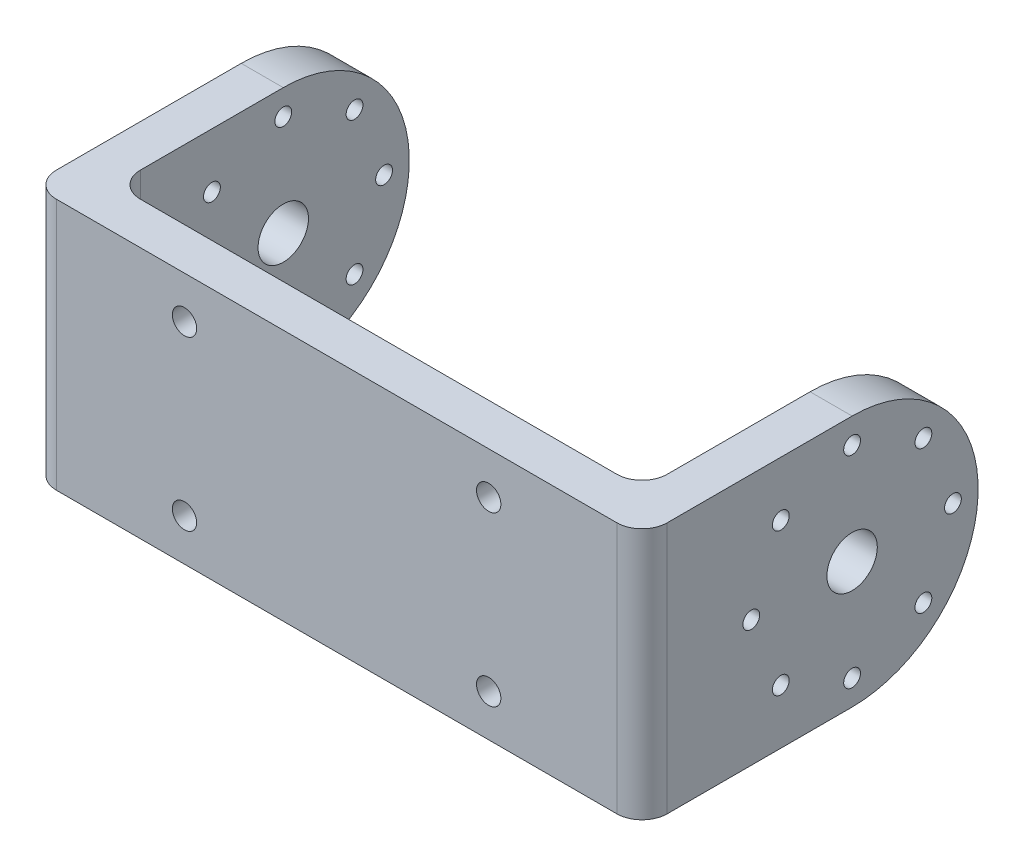
from build123d import *

# Parameters (mm, degrees)
BOSS_EXTRUDE1_DEPTH = 5
SKETCH4_W           = 5
SKETCH4_H           = 30
BOSS_EXTRUDE4_DEPTH = 35
SKETCH5_R           = 3
CUT_EXTRUDE2_DEPTH  = 40
CUT_EXTRUDE3_DEPTH  = 10
SKETCH7_R           = 1
SKETCH7_R_2         = 1.000000019
CUT_EXTRUDE4_DEPTH  = 10
FILLET2_R           = 3
FILLET3_R           = 3
FILLET5_R           = 3
FILLET6_R           = 3
SKETCH8_R           = 1.45
CUT_EXTRUDE6_DEPTH  = 4


with BuildPart() as part:
    # Sketch1 → Boss-Extrude1 (new body)
    with BuildSketch(Plane.XY):
        with BuildLine():
            Line((5, 0), (36.35, 0))
            Line((36.35, 0), (36.35, 15))
            Line((36.35, 15), (-36.35, 15))
            Line((-36.35, 15), (-36.35, 0))
            Line((-36.35, 0), (-5, 0))
            ThreePointArc((-5, 0), (0, 5), (5, 0))
        make_face()
        with BuildLine():
            ThreePointArc((-5, 0), (0, -5), (5, 0))
            Line((5, 0), (0, 0))
            Line((0, 0), (-5, 0))
        make_face()
        with BuildLine():
            Line((0, 0), (5, 0))
            ThreePointArc((5, 0), (0, 5), (-5, 0))
            Line((-5, 0), (0, 0))
        make_face()
        with BuildLine():
            Line((-36.35, -15), (36.35, -15))
            Line((36.35, -15), (36.35, 0))
            Line((36.35, 0), (5, 0))
            ThreePointArc((5, 0), (0, -5), (-5, 0))
            Line((-5, 0), (-36.35, 0))
            Line((-36.35, 0), (-36.35, -15))
        make_face()
    extrude(amount=BOSS_EXTRUDE1_DEPTH)

    # Sketch4 → Boss-Extrude4 (add)
    with BuildSketch(Plane(origin=(0, 0, 0), x_dir=(-1, 0, 0), z_dir=(0, 0, -1))):
        with Locations((-33.85, 0)):
            Rectangle(SKETCH4_W, SKETCH4_H)
    boss_extrude4 = extrude(amount=BOSS_EXTRUDE4_DEPTH)

    # Sketch5 → Cut-Extrude2 (cut)
    with BuildSketch(Plane(origin=(36.35, 0, 0), x_dir=(0, 0, -1), z_dir=(1, 0, 0))):
        with Locations(Location((20, 0, 0), (0, 0, 90))):
            Circle(SKETCH5_R)
    cut_extrude2 = extrude(amount=-CUT_EXTRUDE2_DEPTH, mode=Mode.SUBTRACT)

    # Sketch6 → Cut-Extrude3 (cut)
    with BuildSketch(Plane.ZY.offset(-31.35)):
        with BuildLine():
            ThreePointArc((-35, 0), (-30.606601718, 10.606601718), (-20, 15))
            Line((-20, 15), (-35, 15))
            Line((-35, 15), (-35, 0))
        make_face()
        with BuildLine():
            ThreePointArc((-20, -15), (-30.606601718, -10.606601718), (-35, 0))
            Line((-35, 0), (-35, -15))
            Line((-35, -15), (-20, -15))
        make_face()
    cut_extrude3 = extrude(amount=-CUT_EXTRUDE3_DEPTH, mode=Mode.SUBTRACT)

    # Sketch7 → Cut-Extrude4 (cut)
    with BuildSketch(Plane.ZY.offset(-31.35)):
        with Locations((-28.485281374, 8.485281374)):
            Circle(SKETCH7_R)
        with Locations((-11.514718626, 8.485281374)):
            Circle(SKETCH7_R)
        with Locations((-8, 0)):
            Circle(SKETCH7_R)
        with Locations((-32, -2e-08)):
            Circle(SKETCH7_R_2)
        with Locations((-11.514718626, -8.485281374)):
            Circle(SKETCH7_R)
        with Locations((-20, 12)):
            Circle(SKETCH7_R)
        with Locations((-28.485281374, -8.485281374)):
            Circle(SKETCH7_R)
        with Locations((-20, -12)):
            Circle(SKETCH7_R)
    cut_extrude4 = extrude(amount=-CUT_EXTRUDE4_DEPTH, mode=Mode.SUBTRACT)

    # Fillet2
    fillet2_edges = [part.edges().sort_by_distance(p)[0] for p in [
        (36.35, 0, 5),
    ]]
    fillet(fillet2_edges, radius=FILLET2_R)

    # Fillet3
    fillet3_edges = [part.edges().sort_by_distance(p)[0] for p in [
        (31.35, 0, 0),
    ]]
    fillet(fillet3_edges, radius=FILLET3_R)

    # Mirror2: Boss-Extrude4, Cut-Extrude2, Cut-Extrude3, Cut-Extrude4 across plane
    add(boss_extrude4.mirror(Plane(origin=(0, 0, 0), x_dir=(0, 0, 1), z_dir=(1, 0, 0))))
    add(cut_extrude2.mirror(Plane(origin=(0, 0, 0), x_dir=(0, 0, 1), z_dir=(1, 0, 0))), mode=Mode.SUBTRACT)
    add(cut_extrude3.mirror(Plane(origin=(0, 0, 0), x_dir=(0, 0, 1), z_dir=(1, 0, 0))), mode=Mode.SUBTRACT)
    add(cut_extrude4.mirror(Plane(origin=(0, 0, 0), x_dir=(0, 0, 1), z_dir=(1, 0, 0))), mode=Mode.SUBTRACT)

    # Fillet5
    fillet5_edges = [part.edges().sort_by_distance(p)[0] for p in [
        (-36.35, 0, 5),
    ]]
    fillet(fillet5_edges, radius=FILLET5_R)

    # Fillet6
    fillet6_edges = [part.edges().sort_by_distance(p)[0] for p in [
        (-31.35, 0, 0),
    ]]
    fillet(fillet6_edges, radius=FILLET6_R)

    # Sketch8 → Cut-Extrude6 (cut)
    with BuildSketch(Plane.XY.offset(5)):
        with Locations((-18.1, 10)):
            Circle(SKETCH8_R)
        with Locations((18.1, 10)):
            Circle(SKETCH8_R)
        with Locations((18.1, -10)):
            Circle(SKETCH8_R)
        with Locations((-18.1, -10)):
            Circle(SKETCH8_R)
    extrude(amount=-CUT_EXTRUDE6_DEPTH, mode=Mode.SUBTRACT)


solid = part.part
